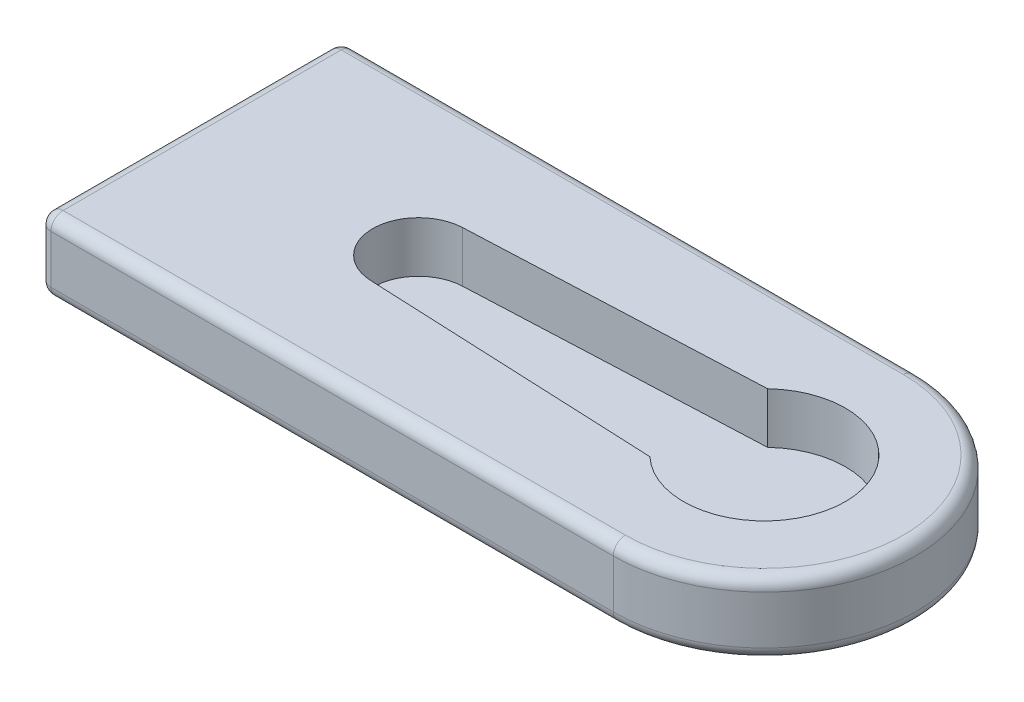
from build123d import *

# Parameters (mm, degrees)
EXTRUDE_1_DEPTH     = 3
FILLET_1_R          = 0.5
CUT_EXTRUDE_1_DEPTH = 2.1


with BuildPart() as part:
    # 草图1 → 凸台-拉伸1 (new body)
    with BuildSketch(Plane(origin=(0, 0, 0), x_dir=(1, 0, 0), z_dir=(0, 1, 0))):
        with BuildLine():
            Line((0, 0), (23.75, 0))
            ThreePointArc((23.75, 0), (30, 6.25), (23.75, 12.5))
            Line((23.75, 12.5), (0, 12.5))
            Line((0, 12.5), (0, 0))
        make_face()
    extrude(amount=EXTRUDE_1_DEPTH)

    # 圆角1
    fillet_1_edges = [part.edges().sort_by_distance(p)[0] for p in [
        (30, 3, -6.25),
        (11.875, 3, -12.5),
        (0, 3, -6.25),
        (11.875, 0, -12.5),
        (30, 0, -6.25),
        (11.875, 0, 0),
        (0, 0, -6.25),
        (0, 1.5, -12.5),
        (0, 1.5, 0),
        (11.875, 3, 0),
    ]]
    fillet(fillet_1_edges, radius=FILLET_1_R)

    # 草图2 → 切除-拉伸1 (cut)
    with BuildSketch(Plane(origin=(0, 3, 0), x_dir=(1, 0, 0), z_dir=(0, 1, 0))):
        with BuildLine():
            Line((9.365836637, 8.148135013), (21.448084588, 8.683862246))
            ThreePointArc((21.448084588, 8.683862246), (27.1, 6.25), (21.448084588, 3.816137754))
            Line((21.448084588, 3.816137754), (9.365836637, 4.351864987))
            ThreePointArc((9.365836637, 4.351864987), (7.55, 6.25), (9.365836637, 8.148135013))
        make_face()
    extrude(amount=-CUT_EXTRUDE_1_DEPTH, mode=Mode.SUBTRACT)


solid = part.part
